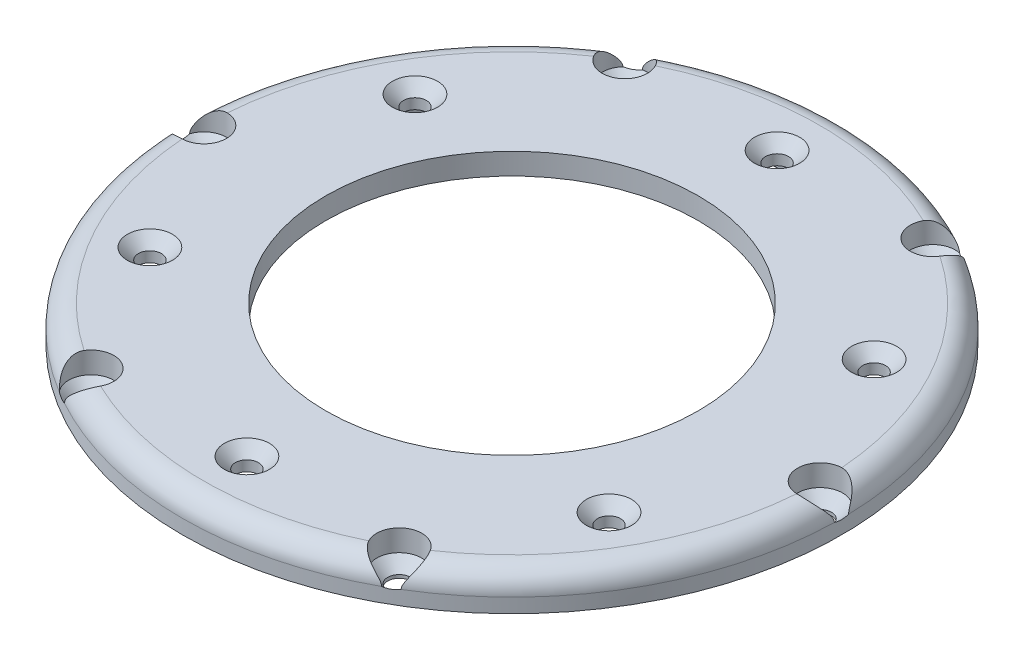
from build123d import *

# Parameters (mm, degrees)
CIRPATTERN1_COUNT                                   = 6
CSK_FOR_M3_COUNTERSUNK_FLAT_HEAD_SCREW2_D           = 3.2
CSK_FOR_M3_COUNTERSUNK_FLAT_HEAD_SCREW2_CSINK_D     = 6.3
CSK_FOR_M3_COUNTERSUNK_FLAT_HEAD_SCREW2_CSINK_ANGLE = 90
CIRPATTERN2_COUNT                                   = 6


with BuildPart() as part:
    # Sketch1 → Revolve1 (revolve)
    with BuildSketch(Plane.XY, mode=Mode.PRIVATE) as revolve1_sk:
        with BuildLine():
            Line((40, 1), (40, 0))
            Line((40, 0), (46, 0))
            Line((46, 0), (46, 2))
            ThreePointArc((46, 2), (45.121320344, 4.121320344), (43, 5))
            Line((43, 5), (26, 5))
            Line((26, 5), (26, 2))
            Line((26, 2), (39, 2))
            ThreePointArc((39, 2), (39.707106781, 1.707106781), (40, 1))
        make_face()
    revolve(revolve1_sk.sketch.rotate(Axis((0, 96.254, 0), (0, -1, 0)), 90), axis=Axis((0, 96.254, 0), (0, -1, 0)))

    # Sketch3 → CSK for M3 Countersunk Flat Head Screw1 (revolve, cut)
    with BuildSketch(Plane(origin=(43, 5, 0), x_dir=(0, 0, 1), z_dir=(1, 0, 0))):
        Polygon((0, 0), (0, 5), (1.6, 5), (1.6, 4.55), (3.15, 3), (3.15, 0), align=None)
    csk_for_m3_countersunk_flat_head_screw1 = revolve(axis=Axis((43, 11.35, 0), (0, -1, 0)), mode=Mode.SUBTRACT)

    # CirPattern1: CSK for M3 Countersunk Flat Head Screw1 ×6 about axis
    cirpattern1_axis = Axis((0, 0, 0), (0, 1, 0))
    for i in range(1, CIRPATTERN1_COUNT):
        add(csk_for_m3_countersunk_flat_head_screw1.rotate(cirpattern1_axis, i * 360 / CIRPATTERN1_COUNT), mode=Mode.SUBTRACT)

    # CSK for M3 Countersunk Flat Head Screw2 (through all)
    with Locations(Plane(origin=(0, 5, 0), x_dir=(1, 0, 0), z_dir=(0, 1, 0))):
        with Locations((0, 37)):
            csk_for_m3_countersunk_flat_head_screw2 = CounterSinkHole(CSK_FOR_M3_COUNTERSUNK_FLAT_HEAD_SCREW2_D / 2, CSK_FOR_M3_COUNTERSUNK_FLAT_HEAD_SCREW2_CSINK_D / 2, counter_sink_angle=CSK_FOR_M3_COUNTERSUNK_FLAT_HEAD_SCREW2_CSINK_ANGLE)

    # CirPattern2: CSK for M3 Countersunk Flat Head Screw2 ×6 about axis
    cirpattern2_axis = Axis((0, 0, 0), (0, 1, 0))
    for i in range(1, CIRPATTERN2_COUNT):
        add(csk_for_m3_countersunk_flat_head_screw2.rotate(cirpattern2_axis, i * 360 / CIRPATTERN2_COUNT), mode=Mode.SUBTRACT)


solid = part.part
